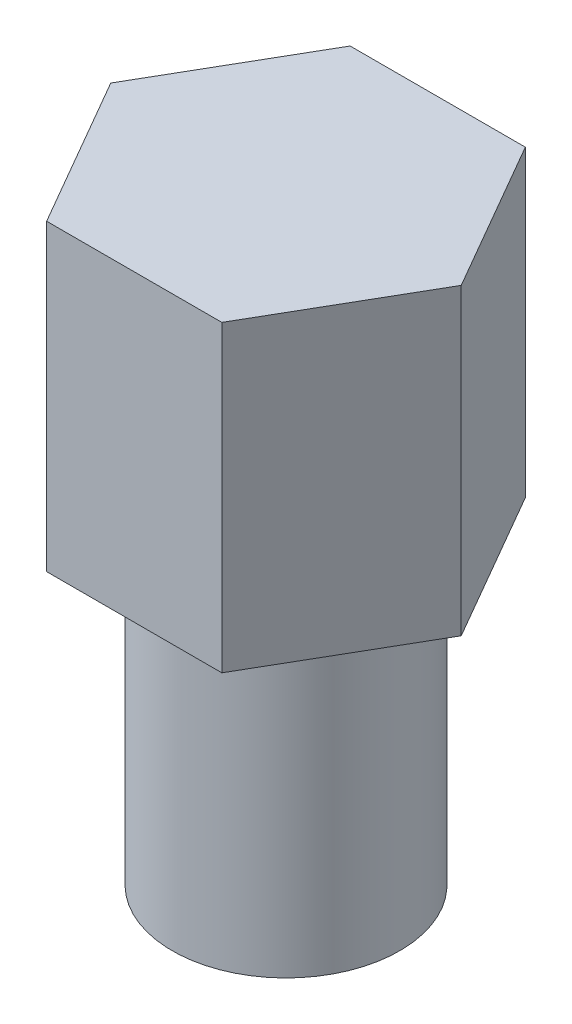
from build123d import *

# Parameters (mm, degrees)
EXTRUDE1_DEPTH = 12.7
SKETCH2_R      = 4.7625
EXTRUDE2_DEPTH = 12.7


with BuildPart() as part:
    # Sketch1 → Extrude1 (new body)
    with BuildSketch(Plane(origin=(0, 0, 0), x_dir=(1, 0, 0), z_dir=(0, 1, 0))):
        Polygon((3.666174209, 6.35), (-3.666174209, 6.35), (-7.332348419, 0), (-3.666174209, -6.35), (3.666174209, -6.35), (7.332348419, 0), align=None)
    extrude(amount=EXTRUDE1_DEPTH)

    # Sketch2 → Extrude2 (add)
    with BuildSketch(Plane.XZ):
        with Locations(Location((0, 0, 0), (0, 0, 270))):
            Circle(SKETCH2_R)
    extrude(amount=EXTRUDE2_DEPTH)


solid = part.part
